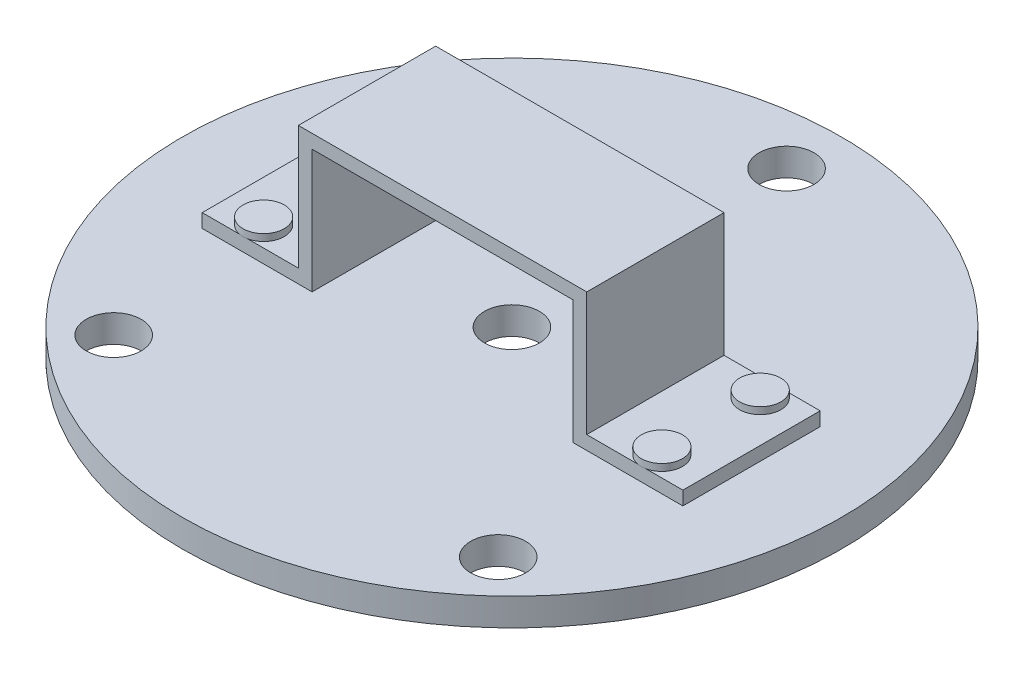
from build123d import *

# Parameters (mm, degrees)
SKETCH1_R               = 120
BOSS_EXTRUDE1_DEPTH     = 10
CUT_EXTRUDE1_DEPTH      = 171
CUT_EXTRUDE1_DEPTH_BACK = 171
SKETCH2_R               = 10
CUT_EXTRUDE2_DEPTH      = 171
CUT_EXTRUDE2_DEPTH_BACK = 171
SKETCH3_R               = 10
SKETCH8_W               = 35
SKETCH8_H               = 50
BOSS_EXTRUDE3_DEPTH     = 5
SKETCH9_W               = 50
SKETCH9_H               = 45
BOSS_EXTRUDE4_DEPTH     = 5
SKETCH10_W              = 105
SKETCH10_H              = 50
BOSS_EXTRUDE5_DEPTH     = 5
SKETCH11_R              = 5
CUT_EXTRUDE3_DEPTH      = 176.570498661
SKETCH12_R              = 7.5
BOSS_EXTRUDE6_DEPTH     = 2.5


with BuildPart() as part:
    # Sketch1 → Boss-Extrude1 (new body)
    with BuildSketch(Plane(origin=(0, 0, 0), x_dir=(1, 0, 0), z_dir=(0, 1, 0))):
        with Locations(Location((0, 0, 0), (0, 0, 270))):
            Circle(SKETCH1_R)
    extrude(amount=BOSS_EXTRUDE1_DEPTH)

    # Sketch2 → Cut-Extrude1 (cut, two sides: drawn at the far end of the back side and taken through both)
    with BuildSketch(Plane(origin=(0, 10, 0), x_dir=(1, 0, 0), z_dir=(0, 1, 0)).offset(-CUT_EXTRUDE1_DEPTH_BACK)):
        with Locations(Location((0, 0, 0), (0, 0, 270))):
            Circle(SKETCH2_R)
    extrude(amount=CUT_EXTRUDE1_DEPTH + CUT_EXTRUDE1_DEPTH_BACK, mode=Mode.SUBTRACT)

    # Sketch3 → Cut-Extrude2 (cut, two sides: drawn at the far end of the back side and taken through both)
    with BuildSketch(Plane(origin=(0, 10, 0), x_dir=(1, 0, 0), z_dir=(0, 1, 0)).offset(-CUT_EXTRUDE2_DEPTH_BACK)):
        with Locations(Location((0, 100, 0), (0, 0, 270))):
            Circle(SKETCH3_R)
        with Locations(Location((-70, -75, 0), (0, 0, 270))):
            Circle(SKETCH3_R)
        with Locations(Location((70, -75, 0), (0, 0, 90))):
            Circle(SKETCH3_R)
    extrude(amount=CUT_EXTRUDE2_DEPTH + CUT_EXTRUDE2_DEPTH_BACK, mode=Mode.SUBTRACT)

    # Sketch8 → Boss-Extrude3 (add)
    with BuildSketch(Plane(origin=(0, 10, 0), x_dir=(1, 0, 0), z_dir=(0, 1, 0))):
        with Locations((-70, -0.262373312)):
            Rectangle(SKETCH8_W, SKETCH8_H)
    boss_extrude3 = extrude(amount=BOSS_EXTRUDE3_DEPTH)

    # Mirror2: Boss-Extrude3 across plane
    add(boss_extrude3.mirror(Plane(origin=(0, 0, 0), x_dir=(0, 0, 1), z_dir=(1, 0, 0))))

    # Sketch9 → Boss-Extrude4 (add)
    with BuildSketch(Plane(origin=(-52.5, 0, 0), x_dir=(0, 0, -1), z_dir=(1, 0, 0))):
        with Locations((-0.262373312, 32.5)):
            Rectangle(SKETCH9_W, SKETCH9_H)
    boss_extrude4 = extrude(amount=BOSS_EXTRUDE4_DEPTH)

    # Mirror3: Boss-Extrude4 across plane
    add(boss_extrude4.mirror(Plane(origin=(0, 0, 0), x_dir=(0, 0, 1), z_dir=(1, 0, 0))))

    # Sketch10 → Boss-Extrude5 (add)
    with BuildSketch(Plane(origin=(0, 55, 0), x_dir=(1, 0, 0), z_dir=(0, 1, 0))):
        with Locations((0, -0.262373312)):
            Rectangle(SKETCH10_W, SKETCH10_H)
    extrude(amount=BOSS_EXTRUDE5_DEPTH)

    # Sketch11 → Cut-Extrude3 (cut, symmetric)
    with BuildSketch(Plane(origin=(0, 15, 0), x_dir=(1, 0, 0), z_dir=(0, 1, 0))):
        with Locations(Location((-72.5, 17.904853765, 0), (0, 0, 270))):
            Circle(SKETCH11_R)
        with Locations(Location((-72.5, -16.970687481, 0), (0, 0, 270))):
            Circle(SKETCH11_R)
    cut_extrude3 = extrude(amount=CUT_EXTRUDE3_DEPTH, both=True, mode=Mode.SUBTRACT)

    # Mirror4: Cut-Extrude3 across plane
    add(cut_extrude3.mirror(Plane(origin=(0, 0, 0), x_dir=(0, 0, 1), z_dir=(1, 0, 0))), mode=Mode.SUBTRACT)

    # Sketch12 → Boss-Extrude6 (add)
    with BuildSketch(Plane(origin=(0, 15, 0), x_dir=(1, 0, 0), z_dir=(0, 1, 0))):
        with Locations(Location((-72.5, 17.904853765, 0), (0, 0, 114.351031906))):
            Circle(SKETCH12_R)
        with Locations(Location((-72.5, -17.904853765, 0), (0, 0, 90))):
            Circle(SKETCH12_R)
    boss_extrude6 = extrude(amount=BOSS_EXTRUDE6_DEPTH)

    # Mirror5: Boss-Extrude6 across plane
    add(boss_extrude6.mirror(Plane(origin=(0, 0, 0), x_dir=(0, 0, 1), z_dir=(1, 0, 0))))


solid = part.part
